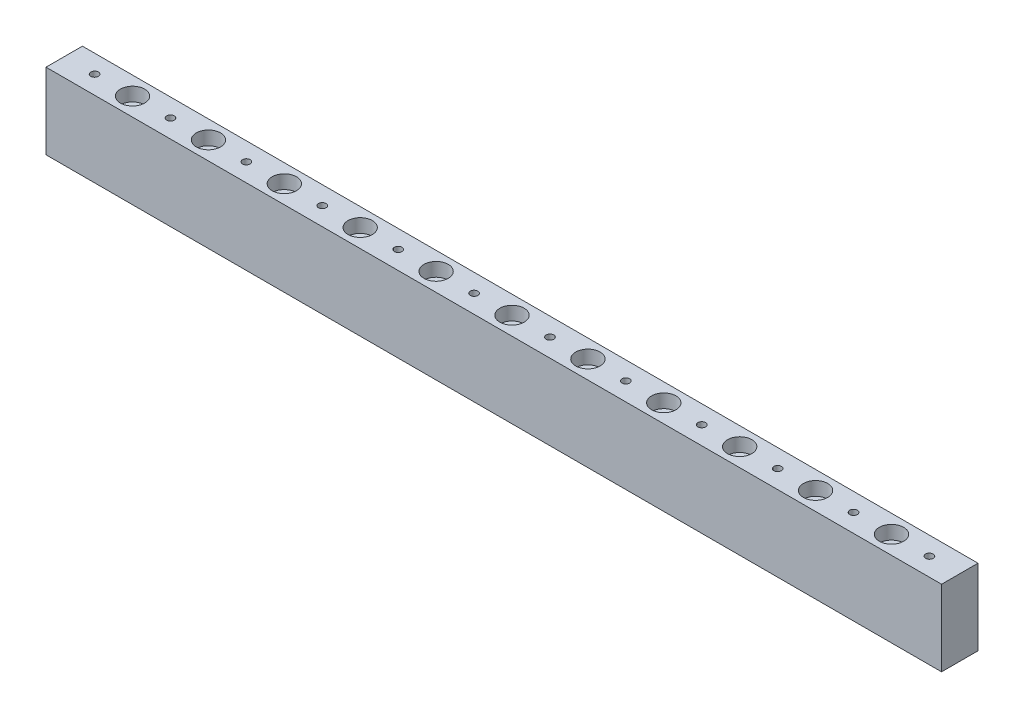
from build123d import *

# Parameters (mm, degrees)
SKETCH_2_W                   = 295
SKETCH_2_H                   = 12
EXTRUDE_1_DEPTH              = 25
PATTERN_LINEAR_1_COUNT       = 12
PATTERN_LINEAR_1_PITCH       = 25
HOLE_WIZARD_M4_1_D           = 4.5
HOLE_WIZARD_M4_1_CBORE_D     = 8
HOLE_WIZARD_M4_1_CBORE_DEPTH = 4.5
PATTERN_LINEAR_2_COUNT       = 11
PATTERN_LINEAR_2_PITCH       = 25


with BuildPart() as part:
    # 草图2 → 拉伸1 (new body)
    with BuildSketch(Plane(origin=(0, 0, 0), x_dir=(1, 0, 0), z_dir=(0, 1, 0))):
        with Locations((147.5, 0)):
            Rectangle(SKETCH_2_W, SKETCH_2_H)
    extrude(amount=EXTRUDE_1_DEPTH)

    # 草图4 → M3 螺纹孔1 (revolve, cut)
    with BuildSketch(Plane(origin=(10, 25, 0), x_dir=(0, 0, 1), z_dir=(1, 0, 0))):
        Polygon((0, 0), (0, 8.251075774), (1.25, 7.5), (1.25, 0), align=None)
    hole_wizard_m3_1 = revolve(axis=Axis((10, 31.35, 0), (0, -1, 0)), mode=Mode.SUBTRACT)

    # 阵列(线性)1: M3 螺纹孔1 ×12
    with Locations(*[(i * PATTERN_LINEAR_1_PITCH, 0, 0) for i in range(1, PATTERN_LINEAR_1_COUNT)]):
        add(hole_wizard_m3_1, mode=Mode.SUBTRACT)

    # M4 六角凹头螺钉的柱形沉头孔1 (through all)
    with Locations(Plane(origin=(262.846314279, 25, 7.813441093), x_dir=(-1, 0, 0), z_dir=(0, 1, 0))):
        with Locations((240.346314279, -7.813441093)):
            hole_wizard_m4_1 = CounterBoreHole(HOLE_WIZARD_M4_1_D / 2, HOLE_WIZARD_M4_1_CBORE_D / 2, HOLE_WIZARD_M4_1_CBORE_DEPTH)

    # 阵列(线性)2: M4 六角凹头螺钉的柱形沉头孔1 ×11
    with Locations(*[(i * PATTERN_LINEAR_2_PITCH, 0, 0) for i in range(1, PATTERN_LINEAR_2_COUNT)]):
        add(hole_wizard_m4_1, mode=Mode.SUBTRACT)


solid = part.part
